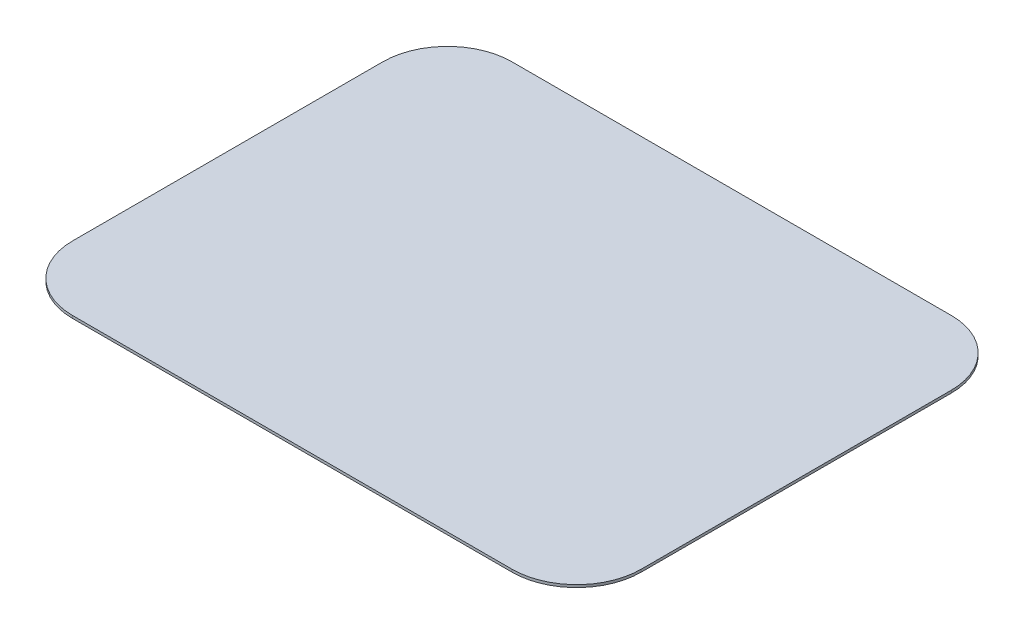
from build123d import *

# Parameters (mm, degrees)
BASE_DEPTH = 0.2


with BuildPart() as part:
    # BaseS → Base (new body)
    with BuildSketch(Plane(origin=(0, 0, 0), x_dir=(1, 0, 0), z_dir=(0, 1, 0))):
        with BuildLine():
            Line((-17, 17), (17, 17))
            ThreePointArc((17, 17), (20.535533906, 15.535533906), (22, 12))
            Line((22, 12), (22, -12))
            ThreePointArc((22, -12), (20.535533906, -15.535533906), (17, -17))
            Line((17, -17), (-17, -17))
            ThreePointArc((-17, -17), (-20.535533906, -15.535533906), (-22, -12))
            Line((-22, -12), (-22, 12))
            ThreePointArc((-22, 12), (-20.535533906, 15.535533906), (-17, 17))
        make_face()
    extrude(amount=-BASE_DEPTH)


solid = part.part
